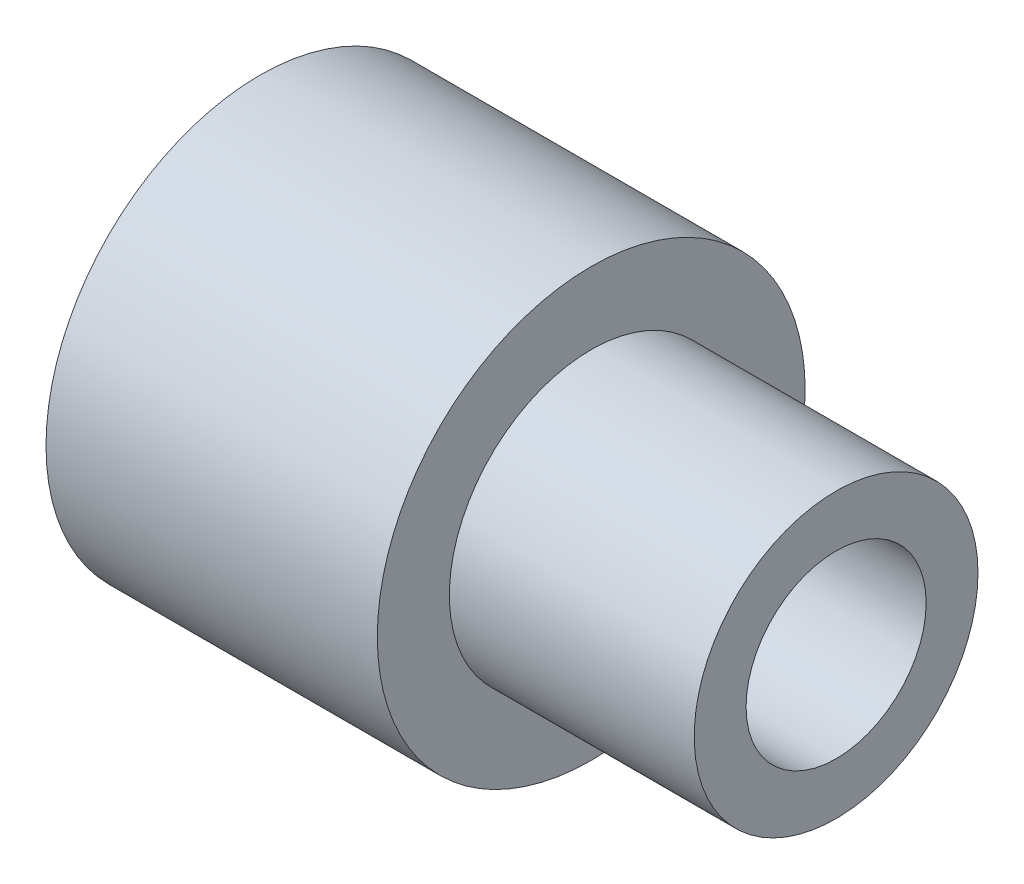
from build123d import *

# Parameters (mm, degrees)
SKETCH1_R           = 3.7719
BOSS_EXTRUDE1_DEPTH = 5.842
SKETCH2_R           = 2.5019
BOSS_EXTRUDE2_DEPTH = 4.318
SKETCH3_R           = 1.5875
CUT_EXTRUDE1_DEPTH  = 12.475193211


with BuildPart() as part:
    # Sketch1 → Boss-Extrude1 (new body)
    with BuildSketch(Plane(origin=(0, 0, 0), x_dir=(0, 0, -1), z_dir=(1, 0, 0))):
        Circle(SKETCH1_R)
    extrude(amount=BOSS_EXTRUDE1_DEPTH)

    # Sketch2 → Boss-Extrude2 (add)
    with BuildSketch(Plane(origin=(5.842, 0, 0), x_dir=(0, 0, -1), z_dir=(1, 0, 0))):
        Circle(SKETCH2_R)
    extrude(amount=BOSS_EXTRUDE2_DEPTH)

    # Sketch3 → Cut-Extrude1 (cut, through all)
    with BuildSketch(Plane(origin=(10.16, 0, 0), x_dir=(0, 0, -1), z_dir=(1, 0, 0))):
        Circle(SKETCH3_R)
    extrude(amount=-CUT_EXTRUDE1_DEPTH, mode=Mode.SUBTRACT)


solid = part.part
